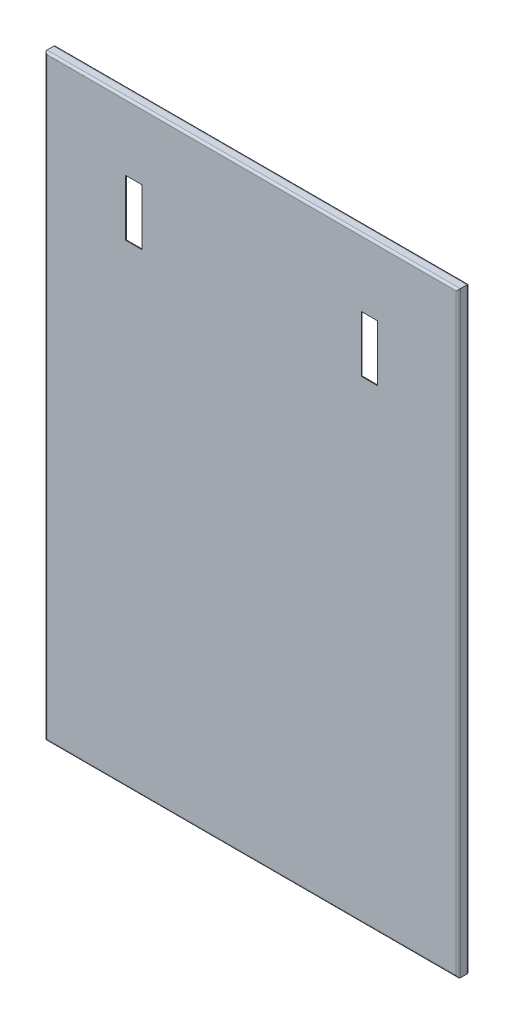
from build123d import *

# Parameters (mm, degrees)
SKETCH_1_W      = 640
SKETCH_1_H      = 924
SKETCH_1_W_2    = 25
SKETCH_1_H_2    = 87
EXTRUDE_1_DEPTH = 1.2
SKETCH_2_W      = 640
SKETCH_2_H      = 924
SKETCH_2_W_2    = 637.6
SKETCH_2_H_2    = 921.6
EXTRUDE_2_DEPTH = 15.5
SKETCH_3_W      = 640
SKETCH_3_H      = 924
SKETCH_3_W_2    = 610
SKETCH_3_H_2    = 894
EXTRUDE_3_DEPTH = 1.2
FILLET_1_R      = 2
FILLET_2_R      = 3.2
FILLET_3_R      = 3.2


with BuildPart() as part:
    # 스케치1 → 보스-돌출1 (new body)
    with BuildSketch(Plane.XY):
        with Locations((320, 462)):
            Rectangle(SKETCH_1_W, SKETCH_1_H)
        with Locations((137.5, 776.5)):
            Rectangle(SKETCH_1_W_2, SKETCH_1_H_2, mode=Mode.SUBTRACT)
        with Locations((502.5, 776.5)):
            Rectangle(SKETCH_1_W_2, SKETCH_1_H_2, mode=Mode.SUBTRACT)
    extrude(amount=EXTRUDE_1_DEPTH)

    # 스케치2 → 보스-돌출2 (add)
    with BuildSketch(Plane(origin=(0, 0, 0), x_dir=(-1, 0, 0), z_dir=(0, 0, -1))):
        with Locations((-320, 462)):
            Rectangle(SKETCH_2_W, SKETCH_2_H)
        with Locations((-320, 462)):
            Rectangle(SKETCH_2_W_2, SKETCH_2_H_2, mode=Mode.SUBTRACT)
    extrude(amount=EXTRUDE_2_DEPTH)

    # 스케치3 → 보스-돌출3 (add)
    with BuildSketch(Plane(origin=(0, 0, -15.5), x_dir=(-1, 0, 0), z_dir=(0, 0, -1))):
        with Locations((-320, 462)):
            Rectangle(SKETCH_3_W, SKETCH_3_H)
        with Locations((-320, 462)):
            Rectangle(SKETCH_3_W_2, SKETCH_3_H_2, mode=Mode.SUBTRACT)
    extrude(amount=-EXTRUDE_3_DEPTH)

    # 필렛1
    fillet_1_edges = [part.edges().sort_by_distance(p)[0] for p in [
        (1.2, 462, 0),
        (320, 922.8, 0),
        (638.8, 462, 0),
        (320, 1.2, 0),
        (638.8, 1.2, -7.15),
        (1.2, 1.2, -7.15),
        (320, 1.2, -14.3),
        (638.8, 922.8, -7.15),
        (1.2, 922.8, -7.15),
        (1.2, 462, -14.3),
        (320, 922.8, -14.3),
        (638.8, 462, -14.3),
    ]]
    fillet(fillet_1_edges, radius=FILLET_1_R)

    # 필렛2
    fillet_2_edges = [part.edges().sort_by_distance(p)[0] for p in [
        (640, 462, 1.2),
        (320, 924, 1.2),
        (0, 462, 1.2),
        (320, 0, 1.2),
    ]]
    fillet(fillet_2_edges, radius=FILLET_2_R)

    # 필렛3
    fillet_3_edges = [part.edges().sort_by_distance(p)[0] for p in [
        (320, 0, -15.5),
        (0, 462, -15.5),
        (320, 924, -15.5),
        (640, 462, -15.5),
    ]]
    fillet(fillet_3_edges, radius=FILLET_3_R)


solid = part.part
